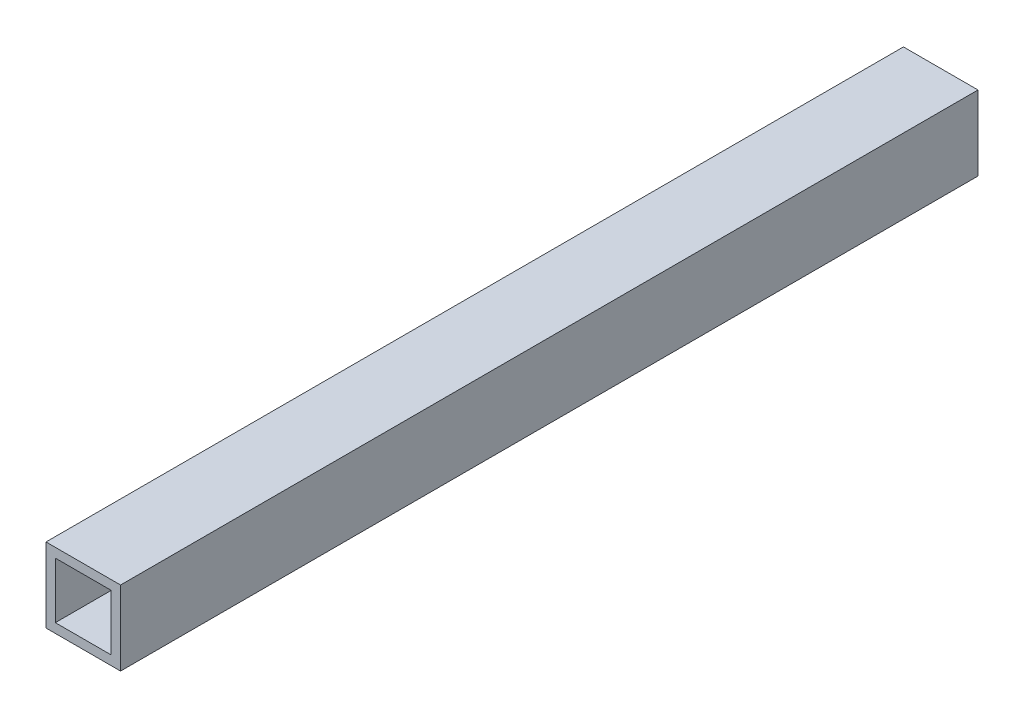
from build123d import *

# Parameters (mm, degrees)
BOSS_EXTRUDE1_DEPTH      = 146.05
BOSS_EXTRUDE1_DEPTH_BACK = 146.05
SKETCH3_W                = 25.4
SKETCH3_H                = 25.4
SKETCH3_W_2              = 19.05
SKETCH3_H_2              = 19.05


with BuildPart() as part:
    # Sketch3 → Boss-Extrude1 (new, two sides: drawn at the far end of the back side and taken through both)
    with BuildSketch(Plane.XY.offset(-BOSS_EXTRUDE1_DEPTH_BACK)):
        Rectangle(SKETCH3_W, SKETCH3_H)
        Rectangle(SKETCH3_W_2, SKETCH3_H_2, mode=Mode.SUBTRACT)
    extrude(amount=BOSS_EXTRUDE1_DEPTH + BOSS_EXTRUDE1_DEPTH_BACK)


solid = part.part
